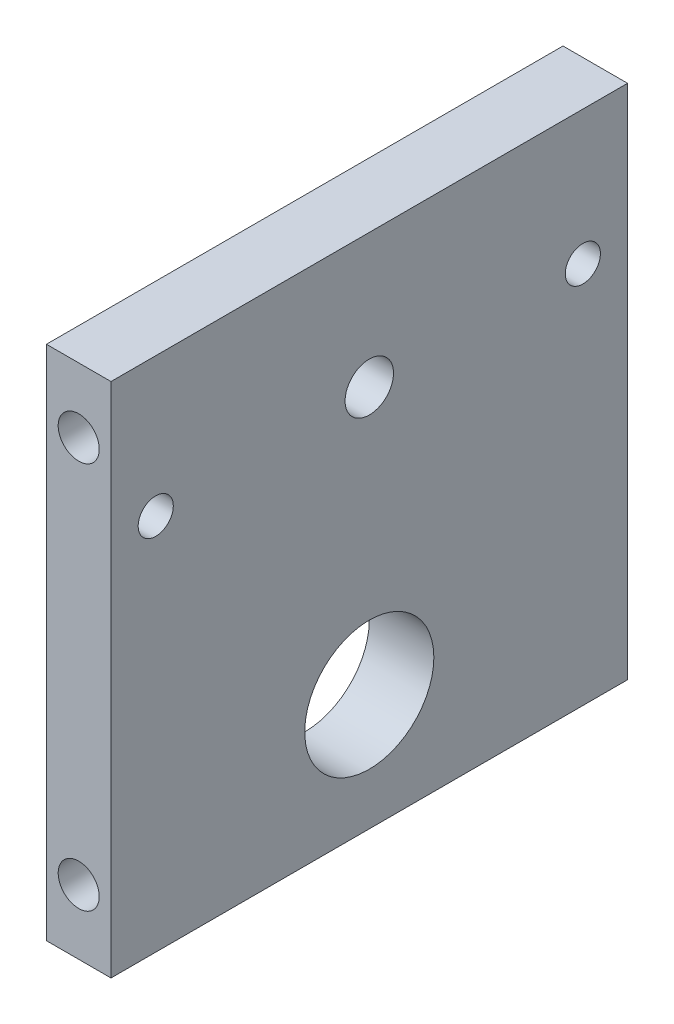
from build123d import *

# Parameters (mm, degrees)
SKETCH1_W                          = 50.8
SKETCH1_H                          = 50.8
BOSS_EXTRUDE1_DEPTH                = 6.35
F_1_2_0_5_DIAMETER_HOLE1_D         = 12.7
F_1_2_0_5_DIAMETER_HOLE1_DEPTH     = 70.104
F_1_2_0_5_DIAMETER_HOLE1_TIP       = 3.815464931
F_3_16_0_1875_DIAMETER_HOLE1_D     = 4.7625
F_3_16_0_1875_DIAMETER_HOLE1_DEPTH = 70.104
F_3_16_0_1875_DIAMETER_HOLE1_TIP   = 1.430799349
F_29_0_136_DIAMETER_HOLE1_D        = 3.4544
F_29_0_136_DIAMETER_HOLE1_DEPTH    = 70.104
F_29_0_136_DIAMETER_HOLE1_TIP      = 1.037806461
F_10_32_TAPPED_HOLE1_D             = 4.0386
F_10_32_TAPPED_HOLE1_DEPTH         = 11.938
F_10_32_TAPPED_HOLE1_TIP           = 1.213317848


with BuildPart() as part:
    # Sketch1 → Boss-Extrude1 (new body)
    with BuildSketch(Plane(origin=(0, 0, 0), x_dir=(0, 0, -1), z_dir=(1, 0, 0))):
        Rectangle(SKETCH1_W, SKETCH1_H)
    extrude(amount=BOSS_EXTRUDE1_DEPTH)

    # 1/2 (0.5) Diameter Hole1
    with Locations(Plane(origin=(6.35, 0, 0), x_dir=(0, 0, -1), z_dir=(1, 0, 0))):
        with Locations((0, -13.97)):
            Hole(F_1_2_0_5_DIAMETER_HOLE1_D / 2, depth=F_1_2_0_5_DIAMETER_HOLE1_DEPTH)
            with Locations((0, 0, -(F_1_2_0_5_DIAMETER_HOLE1_DEPTH + F_1_2_0_5_DIAMETER_HOLE1_TIP / 2))):  # 118° drill point
                Cone(0, F_1_2_0_5_DIAMETER_HOLE1_D / 2, F_1_2_0_5_DIAMETER_HOLE1_TIP, mode=Mode.SUBTRACT)

    # 3/16 (0.1875) Diameter Hole1
    with Locations(Plane(origin=(6.35, 0, 0), x_dir=(0, 0, -1), z_dir=(1, 0, 0))):
        with Locations((0, 12.2301)):
            Hole(F_3_16_0_1875_DIAMETER_HOLE1_D / 2, depth=F_3_16_0_1875_DIAMETER_HOLE1_DEPTH)
            with Locations((0, 0, -(F_3_16_0_1875_DIAMETER_HOLE1_DEPTH + F_3_16_0_1875_DIAMETER_HOLE1_TIP / 2))):  # 118° drill point
                Cone(0, F_3_16_0_1875_DIAMETER_HOLE1_D / 2, F_3_16_0_1875_DIAMETER_HOLE1_TIP, mode=Mode.SUBTRACT)

    # #29 (0.136) Diameter Hole1
    with Locations(Plane(origin=(6.35, 0, 0), x_dir=(0, 0, -1), z_dir=(1, 0, 0))):
        with Locations((21, 12.2301), (-21, 11.74145915)):
            Hole(F_29_0_136_DIAMETER_HOLE1_D / 2, depth=F_29_0_136_DIAMETER_HOLE1_DEPTH)
            with Locations((0, 0, -(F_29_0_136_DIAMETER_HOLE1_DEPTH + F_29_0_136_DIAMETER_HOLE1_TIP / 2))):  # 118° drill point
                Cone(0, F_29_0_136_DIAMETER_HOLE1_D / 2, F_29_0_136_DIAMETER_HOLE1_TIP, mode=Mode.SUBTRACT)

    # #10-32 Tapped Hole1
    with Locations(Plane(origin=(-0.103043464, -5.333920775, 25.4), x_dir=(-1, 0, 0), z_dir=(0, 0, 1))):
        with Locations((-3.278043464, 13.716079225), (-3.278043464, -24.383920775)):
            Hole(F_10_32_TAPPED_HOLE1_D / 2, depth=F_10_32_TAPPED_HOLE1_DEPTH)
            with Locations((0, 0, -(F_10_32_TAPPED_HOLE1_DEPTH + F_10_32_TAPPED_HOLE1_TIP / 2))):  # 118° drill point
                Cone(0, F_10_32_TAPPED_HOLE1_D / 2, F_10_32_TAPPED_HOLE1_TIP, mode=Mode.SUBTRACT)


solid = part.part
